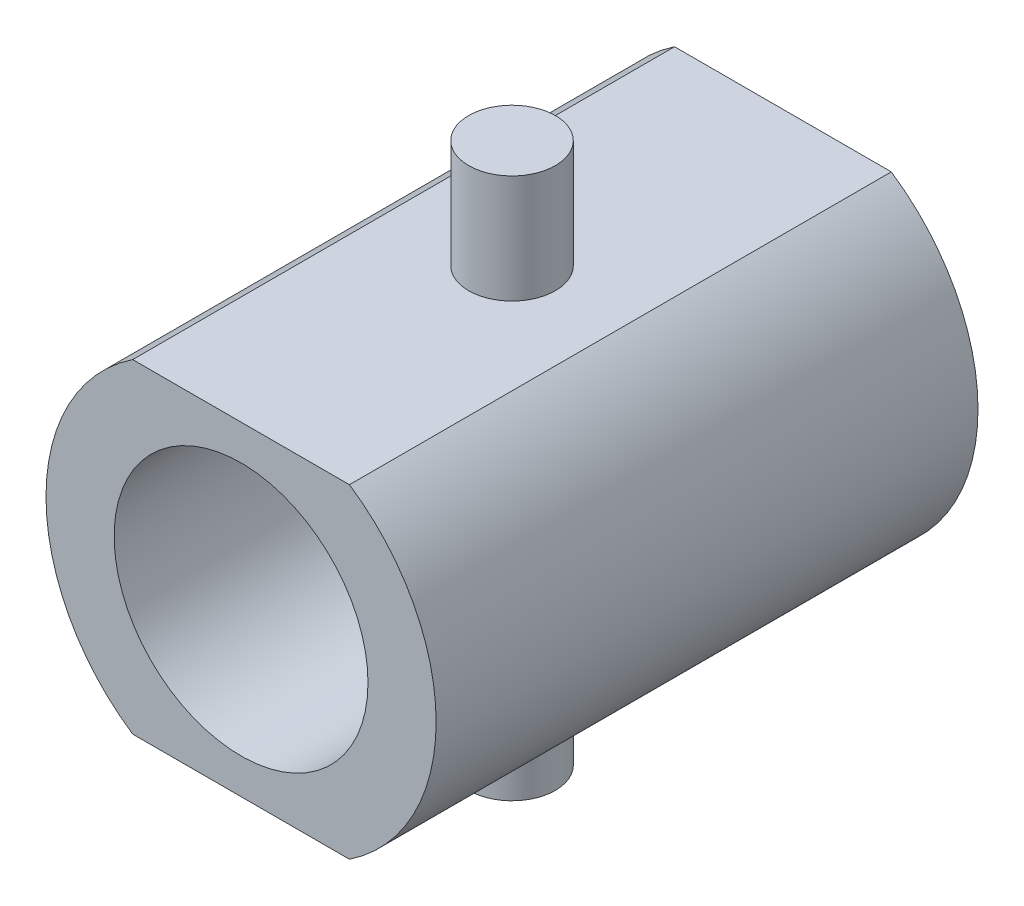
from build123d import *

# Parameters (mm, degrees)
ESQUISSE1_R        = 29.281018542
BOSS_EXTRU_1_DEPTH = 125
ESQUISSE2_R        = 10
BOSS_EXTRU_2_DEPTH = 25


with BuildPart() as part:
    # Esquisse1 → Boss.-Extru.1 (new body)
    with BuildSketch(Plane.XY):
        with BuildLine():
            Line((25, 37.416573868), (-25, 37.416573868))
            ThreePointArc((-25, 37.416573868), (-45, 0), (-25, -37.416573868))
            Line((-25, -37.416573868), (25, -37.416573868))
            ThreePointArc((25, -37.416573868), (39.686269666, -21.213203436), (45, 0))
            ThreePointArc((45, 0), (39.686269666, 21.213203436), (25, 37.416573868))
        make_face()
        Circle(ESQUISSE1_R, mode=Mode.SUBTRACT)
    extrude(amount=BOSS_EXTRU_1_DEPTH)

    # Esquisse2 → Boss.-Extru.2 (add)
    with BuildSketch(Plane(origin=(0, 37.416573868, 0), x_dir=(1, 0, 0), z_dir=(0, 1, 0))):
        with Locations(Location((0, -62.5, 0), (0, 0, 270))):
            Circle(ESQUISSE2_R)
    boss_extru_2 = extrude(amount=BOSS_EXTRU_2_DEPTH)

    # Symétrie1: Boss.-Extru.2 across plane
    add(boss_extru_2.mirror(Plane.ZX))


solid = part.part
